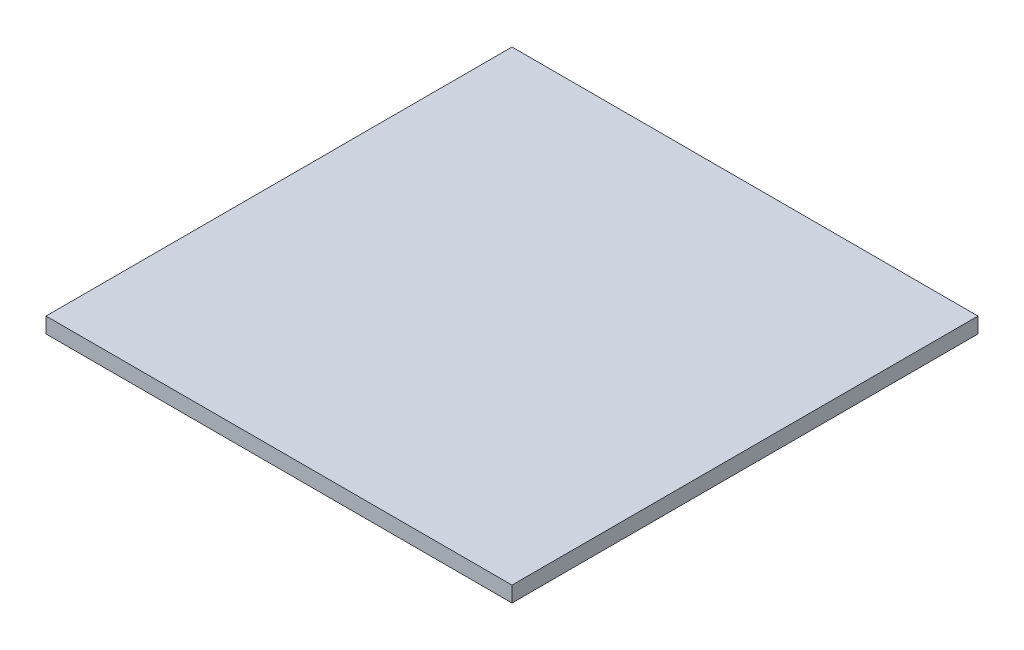
from build123d import *

# Parameters (mm, degrees)
SKETCH1_W           = 762
SKETCH1_H           = 762
BOSS_EXTRUDE1_DEPTH = 25.4


with BuildPart() as part:
    # Sketch1 → Boss-Extrude1 (new body)
    with BuildSketch(Plane(origin=(0, 0, 0), x_dir=(1, 0, 0), z_dir=(0, 1, 0))):
        with Locations((381, 381)):
            Rectangle(SKETCH1_W, SKETCH1_H)
    extrude(amount=BOSS_EXTRUDE1_DEPTH)


solid = part.part
